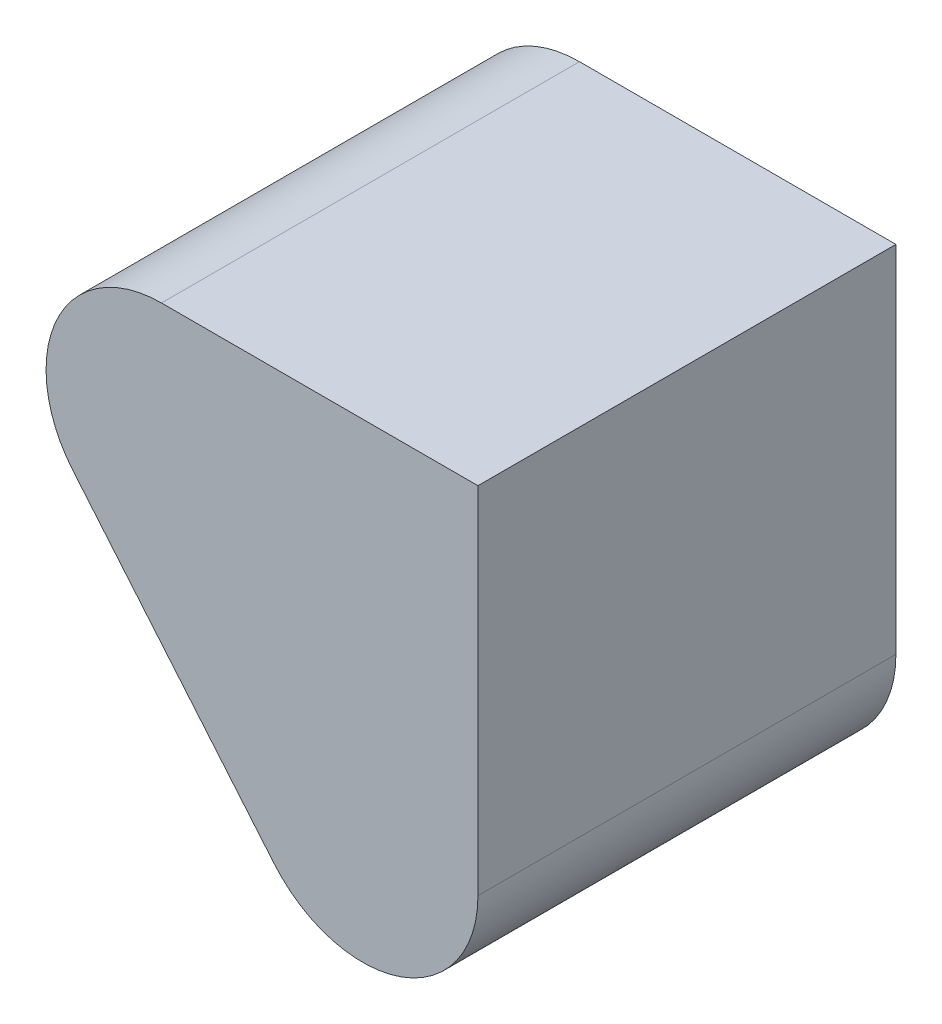
from build123d import *

# Parameters (mm, degrees)
EXTRUDE_1_DEPTH = 40


with BuildPart() as part:
    # 草图1 → 凸台-拉伸1 (new body)
    with BuildSketch(Plane.XY):
        with BuildLine():
            Line((-8.460821473, -7.099472177), (-27.703402524, 15.832942921))
            ThreePointArc((-27.703402524, 15.832942921), (-29.252585633, 27.600156893), (-19.242581051, 33.977233123))
            Line((-19.242581051, 33.977233123), (11.044818024, 33.977233123))
            Line((11.044818024, 33.977233123), (11.044818024, 0))
            ThreePointArc((11.044818024, 0), (3.777550244, -10.378733995), (-8.460821473, -7.099472177))
        make_face()
    extrude(amount=EXTRUDE_1_DEPTH)


solid = part.part
